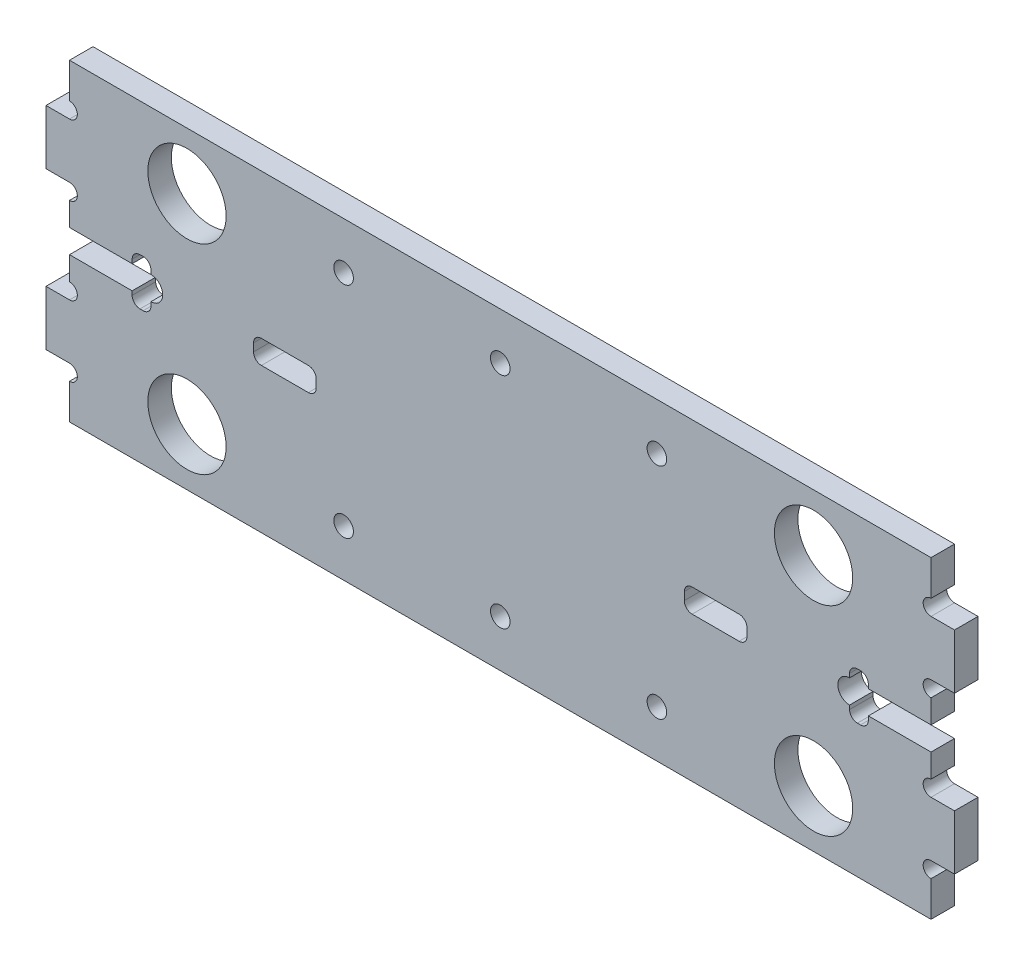
from build123d import *

# Parameters (mm, degrees)
SKETCH1_W           = 110
SKETCH1_H           = 40
BOSS_EXTRUDE1_DEPTH = 3
BOSS_EXTRUDE2_DEPTH = 3
SKETCH3_R           = 1
CUT_EXTRUDE1_DEPTH  = 3
SKETCH4_W           = 8
SKETCH4_H           = 3
SKETCH4_W_2         = 2.4
SKETCH4_H_2         = 6
CUT_EXTRUDE2_DEPTH  = 3
FILLET6_R           = 1
SKETCH5_W           = 8
SKETCH5_H           = 3
CUT_EXTRUDE3_DEPTH  = 10
FILLET7_R           = 1
SKETCH6_R           = 1.25
CUT_EXTRUDE4_DEPTH  = 62.424750712
SKETCH7_R           = 5
CUT_EXTRUDE5_DEPTH  = 10


with BuildPart() as part:
    # Sketch1 → Boss-Extrude1 (new body)
    with BuildSketch(Plane.XY):
        Rectangle(SKETCH1_W, SKETCH1_H)
    extrude(amount=BOSS_EXTRUDE1_DEPTH)

    # Sketch2 → Boss-Extrude2 (add)
    with BuildSketch(Plane.XY.offset(3)):
        Polygon((58, 10), (58, 13.5), (55, 13.5), (55, 6.5), (58, 6.5), align=None)
        Polygon((55, -10), (55, -6.5), (58, -6.5), (58, -13.5), (55, -13.5), align=None)
        Polygon((-55, 6.5), (-55, 13.5), (-58, 13.5), (-58, 10), (-58, 6.5), align=None)
        Polygon((-55, -13.5), (-55, -10), (-55, -6.5), (-58, -6.5), (-58, -13.5), align=None)
    extrude(amount=-BOSS_EXTRUDE2_DEPTH)

    # Sketch3 → Cut-Extrude1 (cut)
    with BuildSketch(Plane.XY.offset(3)):
        with Locations((-55, 14.5)):
            Circle(SKETCH3_R)
        with Locations((-55, 5.5)):
            Circle(SKETCH3_R)
        with Locations((-55, -5.5)):
            Circle(SKETCH3_R)
        with Locations((-55, -14.5)):
            Circle(SKETCH3_R)
        with Locations((55, 14.5)):
            Circle(SKETCH3_R)
        with Locations((55, 5.5)):
            Circle(SKETCH3_R)
        with Locations((55, -5.5)):
            Circle(SKETCH3_R)
        with Locations((55, -14.5)):
            Circle(SKETCH3_R)
    extrude(amount=-CUT_EXTRUDE1_DEPTH, mode=Mode.SUBTRACT)

    # Sketch4 → Cut-Extrude2 (cut)
    with BuildSketch(Plane.XY.offset(3)):
        with Locations((-51, 0)):
            Rectangle(SKETCH4_W, SKETCH4_H)
        Polygon((-47, 3), (-47, 1.5), (-47, -1.5), (-47, -3), (-44.6, -3), (-44.6, -1.5), (-44.6, 1.5), (-44.6, 3), align=None)
        with BuildLine():
            ThreePointArc((-44.6, -1.5), (-43.1, 0), (-44.6, 1.5))
            Line((-44.6, 1.5), (-44.6, -1.5))
        make_face()
        with Locations((45.8, 0)):
            Rectangle(SKETCH4_W_2, SKETCH4_H_2)
        with BuildLine():
            Line((44.6, -1.5), (44.6, 1.5))
            ThreePointArc((44.6, 1.5), (43.1, 0), (44.6, -1.5))
        make_face()
        with Locations((51, 0)):
            Rectangle(SKETCH4_W, SKETCH4_H)
    extrude(amount=-CUT_EXTRUDE2_DEPTH, mode=Mode.SUBTRACT)

    # Fillet6
    fillet6_edges = [part.edges().sort_by_distance(p)[0] for p in [
        (-47, 3, 1.5),
        (-44.6, 3, 1.5),
        (-44.6, -3, 1.5),
        (-47, -3, 1.5),
        (47, 3, 1.5),
        (47, -3, 1.5),
        (44.6, -3, 1.5),
        (44.6, 3, 1.5),
    ]]
    fillet(fillet6_edges, radius=FILLET6_R)

    # Sketch5 → Cut-Extrude3 (cut)
    with BuildSketch(Plane.XY.offset(3)):
        with Locations((-27.5, 0)):
            Rectangle(SKETCH5_W, SKETCH5_H)
        with Locations((27.5, 0)):
            Rectangle(SKETCH5_W, SKETCH5_H)
    extrude(amount=-CUT_EXTRUDE3_DEPTH, mode=Mode.SUBTRACT)

    # Fillet7
    fillet7_edges = [part.edges().sort_by_distance(p)[0] for p in [
        (-23.5, 1.5, 1.5),
        (-23.5, -1.5, 1.5),
        (-31.5, -1.5, 1.5),
        (-31.5, 1.5, 1.5),
        (31.5, 1.5, 1.5),
        (31.5, -1.5, 1.5),
        (23.5, -1.5, 1.5),
        (23.5, 1.5, 1.5),
    ]]
    fillet(fillet7_edges, radius=FILLET7_R)

    # Sketch6 → Cut-Extrude4 (cut, through all)
    with BuildSketch(Plane.XY.offset(3)):
        with Locations((-40, -14)):
            Circle(SKETCH6_R)
        with Locations((-20, -14)):
            Circle(SKETCH6_R)
        with Locations((0, -14)):
            Circle(SKETCH6_R)
        with Locations((20, -14)):
            Circle(SKETCH6_R)
        with Locations((40, -14)):
            Circle(SKETCH6_R)
        with Locations((40, 14)):
            Circle(SKETCH6_R)
        with Locations((20, 14)):
            Circle(SKETCH6_R)
        with Locations((0, 14)):
            Circle(SKETCH6_R)
        with Locations((-20, 14)):
            Circle(SKETCH6_R)
        with Locations((-40, 14)):
            Circle(SKETCH6_R)
    extrude(amount=-CUT_EXTRUDE4_DEPTH, mode=Mode.SUBTRACT)

    # Sketch7 → Cut-Extrude5 (cut)
    with BuildSketch(Plane.XY.offset(3)):
        with Locations((-40, 12.75)):
            Circle(SKETCH7_R)
        with Locations((-40, -12.75)):
            Circle(SKETCH7_R)
        with Locations((40, 12.75)):
            Circle(SKETCH7_R)
        with Locations((40, -12.75)):
            Circle(SKETCH7_R)
    extrude(amount=-CUT_EXTRUDE5_DEPTH, mode=Mode.SUBTRACT)


solid = part.part
